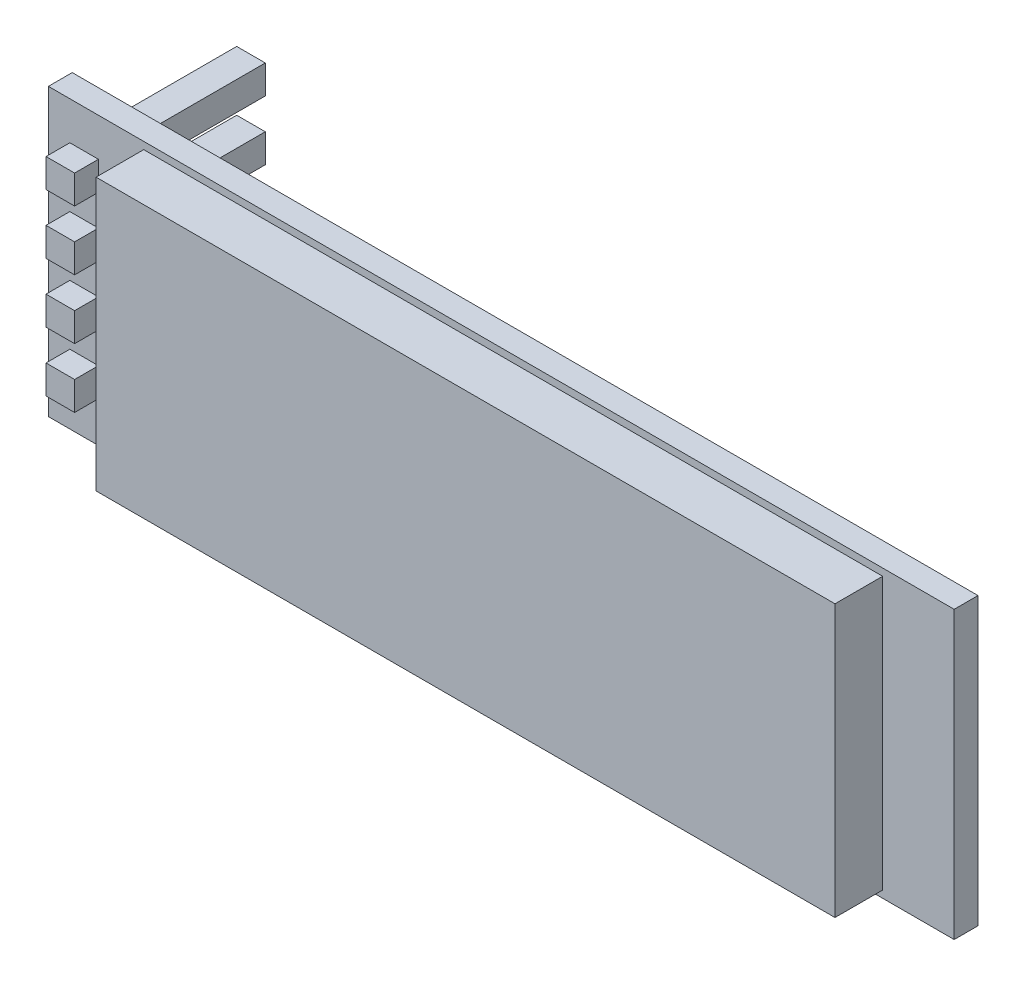
from build123d import *

# Parameters (mm, degrees)
SKETCH_1_W           = 38
SKETCH_1_H           = 12
EXTRUDE_4_DEPTH      = 1
SKETCH_2_W           = 31
SKETCH_2_H           = 11.4
EXTRUDE_5_DEPTH      = 3
SKETCH_3_W           = 1.2
SKETCH_3_H           = 1.2
EXTRUDE_6_DEPTH      = 2
EXTRUDE_7_DEPTH      = 2
EXTRUDE_7_DEPTH_BACK = 6
SKETCH_3_5_W         = 1.2
SKETCH_3_5_H         = 1.2


with BuildPart() as part:
    # ｽｹｯﾁ1 → ﾎﾞｽ - 押し出し4 (new body)
    with BuildSketch(Plane.XY):
        Rectangle(SKETCH_1_W, SKETCH_1_H)
    extrude(amount=EXTRUDE_4_DEPTH)

    # ｽｹｯﾁ2 → ﾎﾞｽ - 押し出し5 (add)
    with BuildSketch(Plane.XY):
        with Locations((0.5, 0)):
            Rectangle(SKETCH_2_W, SKETCH_2_H)
    extrude(amount=EXTRUDE_5_DEPTH)

    # ｽｹｯﾁ3 → ﾎﾞｽ - 押し出し6 (add)
    with BuildSketch(Plane.XY):
        with Locations((-17.5, 3.8)):
            Rectangle(SKETCH_3_W, SKETCH_3_H)
        with Locations((-17.5, 1.3)):
            Rectangle(SKETCH_3_W, SKETCH_3_H)
        with Locations((-17.5, -1.2)):
            Rectangle(SKETCH_3_W, SKETCH_3_H)
        with Locations((-17.5, -3.7)):
            Rectangle(SKETCH_3_W, SKETCH_3_H)
    extrude(amount=EXTRUDE_6_DEPTH)

    # ｽｹｯﾁ3<5> → ﾎﾞｽ - 押し出し7 (add, two sides: drawn at the far end of the back side and taken through both)
    with BuildSketch(Plane.XY.offset(-EXTRUDE_7_DEPTH_BACK)):
        with Locations((-17.5, 3.8)):
            Rectangle(SKETCH_3_5_W, SKETCH_3_5_H)
        with Locations((-17.5, 1.3)):
            Rectangle(SKETCH_3_5_W, SKETCH_3_5_H)
        with Locations((-17.5, -1.2)):
            Rectangle(SKETCH_3_5_W, SKETCH_3_5_H)
        with Locations((-17.5, -3.7)):
            Rectangle(SKETCH_3_5_W, SKETCH_3_5_H)
    extrude(amount=EXTRUDE_7_DEPTH + EXTRUDE_7_DEPTH_BACK)


solid = part.part
